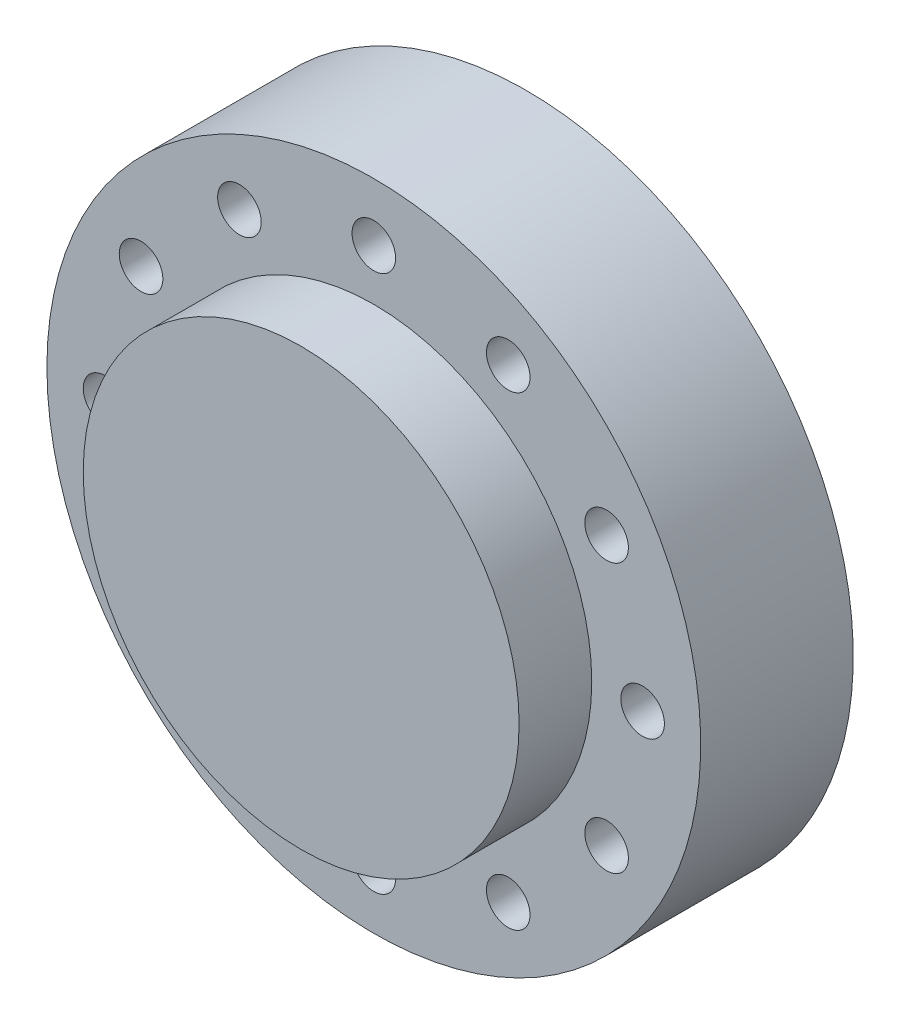
from build123d import *

# Parameters (mm, degrees)
SKETCH_1_R               = 22.5
EXTRUDE_1_DEPTH          = 10.5
SKETCH_2_R               = 15
EXTRUDE_2_DEPTH          = 5
SKETCH_3_R               = 1.5
CUT_EXTRUDE_1_DEPTH      = 5
SKETCH_5_R               = 1.5
CUT_EXTRUDE_2_DEPTH      = 34.507461856
CUT_EXTRUDE_6_DEPTH      = 3
PATTERN_CIRCULAR_1_COUNT = 12


with BuildPart() as part:
    # 草图1 → 凸台-拉伸1 (new body)
    with BuildSketch(Plane.XY):
        with Locations(Location((0, 0, 0), (0, 0, 180))):
            Circle(SKETCH_1_R)
    extrude(amount=EXTRUDE_1_DEPTH)

    # 草图2 → 凸台-拉伸2 (add)
    with BuildSketch(Plane.XY.offset(10.5)):
        Circle(SKETCH_2_R)
    extrude(amount=EXTRUDE_2_DEPTH)

    # 草图3 → 切除-拉伸1 (cut)
    with BuildSketch(Plane.XY.offset(10.5)):
        with Locations((0, 18.5)):
            Circle(SKETCH_3_R)
    cut_extrude_1 = extrude(amount=-CUT_EXTRUDE_1_DEPTH, mode=Mode.SUBTRACT)

    # 草图5 → 切除-拉伸2 (cut, through all)
    with BuildSketch(Plane.XY.offset(10.5)):
        with Locations((0, 18.5)):
            Circle(SKETCH_5_R)
    cut_extrude_2 = extrude(amount=-CUT_EXTRUDE_2_DEPTH, mode=Mode.SUBTRACT)

    # 草图9 → 切除-拉伸6 (cut)
    with BuildSketch(Plane(origin=(0, 0, 0), x_dir=(-1, 0, 0), z_dir=(0, 0, -1))):
        Polygon((1.313991975, 21.705218415), (-2.118804585, 21.240559639), (-3.43279656, 18.035341223), (-1.313991975, 15.294781585), (2.118804585, 15.759440361), (3.43279656, 18.964658777), align=None)
    cut_extrude_6 = extrude(amount=-CUT_EXTRUDE_6_DEPTH, mode=Mode.SUBTRACT)

    # 阵列(圆周)1: 切除-拉伸1, 切除-拉伸2, 切除-拉伸6 ×12 about axis
    pattern_circular_1_axis = Axis((0, 0, 0), (0, 0, 1))
    add([cut_extrude_1.rotate(pattern_circular_1_axis, i * 360 / PATTERN_CIRCULAR_1_COUNT) for i in range(1, PATTERN_CIRCULAR_1_COUNT)], mode=Mode.SUBTRACT)
    add([cut_extrude_2.rotate(pattern_circular_1_axis, i * 360 / PATTERN_CIRCULAR_1_COUNT) for i in range(1, PATTERN_CIRCULAR_1_COUNT)], mode=Mode.SUBTRACT)
    add([cut_extrude_6.rotate(pattern_circular_1_axis, i * 360 / PATTERN_CIRCULAR_1_COUNT) for i in range(1, PATTERN_CIRCULAR_1_COUNT)], mode=Mode.SUBTRACT)


solid = part.part
